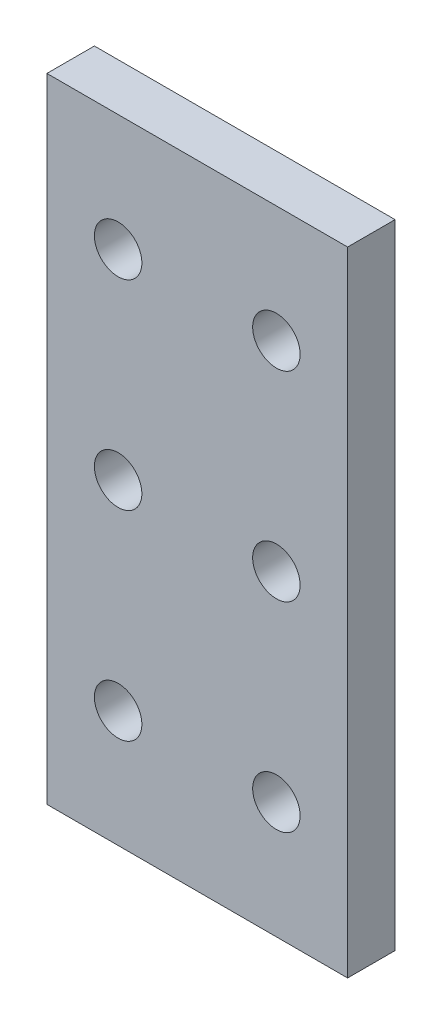
from build123d import *

# Parameters (mm, degrees)
SKETCH12_W          = 19
SKETCH12_H          = 40
SKETCH12_R          = 1.5
BOSS_EXTRUDE6_DEPTH = 3


with BuildPart() as part:
    # Sketch12 → Boss-Extrude6 (new body)
    with BuildSketch(Plane.XY):
        with Locations((-9.5, 0)):
            Rectangle(SKETCH12_W, SKETCH12_H)
        with Locations((-4.5, 0)):
            Circle(SKETCH12_R, mode=Mode.SUBTRACT)
        with Locations((-4.5, -12.625)):
            Circle(SKETCH12_R, mode=Mode.SUBTRACT)
        with Locations((-14.5, -12.625)):
            Circle(SKETCH12_R, mode=Mode.SUBTRACT)
        with Locations((-4.5, 12.625)):
            Circle(SKETCH12_R, mode=Mode.SUBTRACT)
        with Locations((-14.5, 12.625)):
            Circle(SKETCH12_R, mode=Mode.SUBTRACT)
        with Locations((-14.5, 0)):
            Circle(SKETCH12_R, mode=Mode.SUBTRACT)
    extrude(amount=BOSS_EXTRUDE6_DEPTH)


solid = part.part
